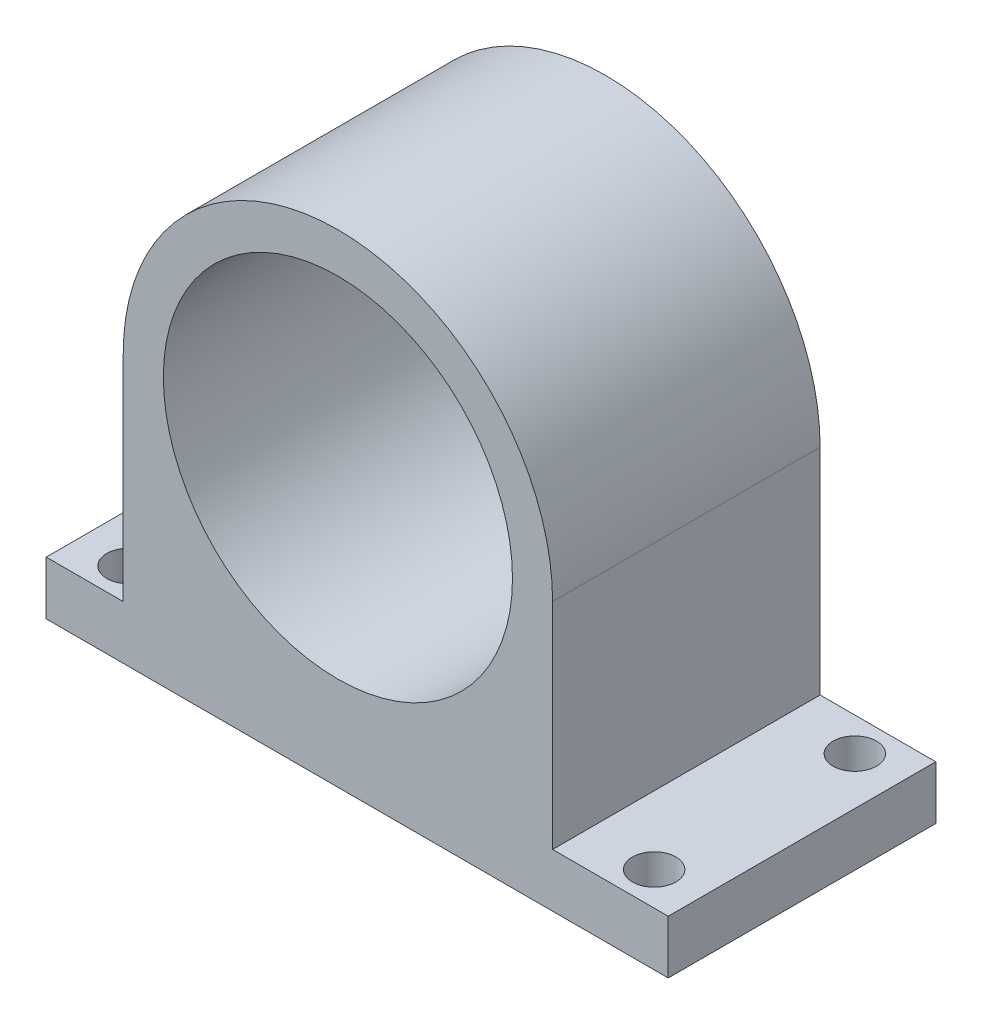
from build123d import *

# Parameters (mm, degrees)
SKETCH_1_R              = 26.1
EXTRUDE_1_DEPTH         = 40
HOLE_WIZARD_6_5_6_5_1_D = 6.5


with BuildPart() as part:
    # 草图1 → 凸台-拉伸1 (new body)
    with BuildSketch(Plane.XY):
        with BuildLine():
            Line((-32.1, 0), (-32.1, -32.1))
            Line((-32.1, -32.1), (-43.611358786, -32.1))
            Line((-43.611358786, -32.1), (-43.611358786, -40.1))
            Line((-43.611358786, -40.1), (49.388641214, -40.1))
            Line((49.388641214, -40.1), (49.388641214, -32.1))
            Line((49.388641214, -32.1), (32.1, -32.1))
            Line((32.1, -32.1), (32.1, 0))
            ThreePointArc((32.1, 0), (0, 32.1), (-32.1, 0))
        make_face()
        Circle(SKETCH_1_R, mode=Mode.SUBTRACT)
    extrude(amount=EXTRUDE_1_DEPTH)

    # Ø6.5 (6.5) 直径孔1 (through all)
    with Locations(Plane(origin=(0, -32.1, 0), x_dir=(1, 0, 0), z_dir=(0, 1, 0))):
        with Locations((42.285158123, -5), (42.285158123, -35), (-36.314841877, -35), (-36.314841877, -5)):
            Hole(HOLE_WIZARD_6_5_6_5_1_D / 2)


solid = part.part
